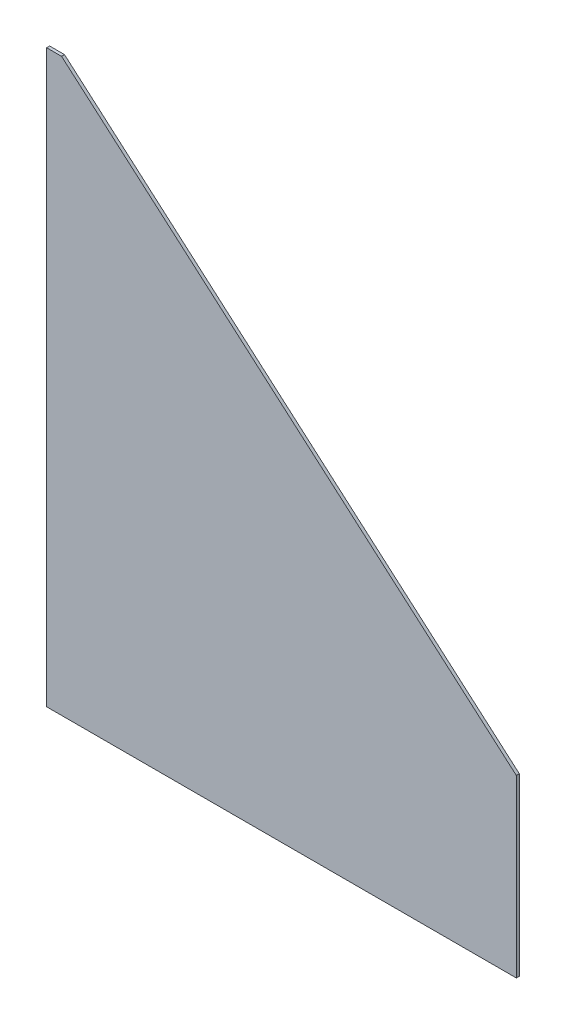
from build123d import *

# Parameters (mm, degrees)
BOSS_EXTRUDE1_DEPTH = 12.7


with BuildPart() as part:
    # Sketch1 → Boss-Extrude1 (new body)
    with BuildSketch(Plane.XY):
        Polygon((0, 0), (-2006.6, 0), (-2006.6, 2438.4), (-1943.1, 2438.4), (0, 749.3), align=None)
    extrude(amount=-BOSS_EXTRUDE1_DEPTH)


solid = part.part
